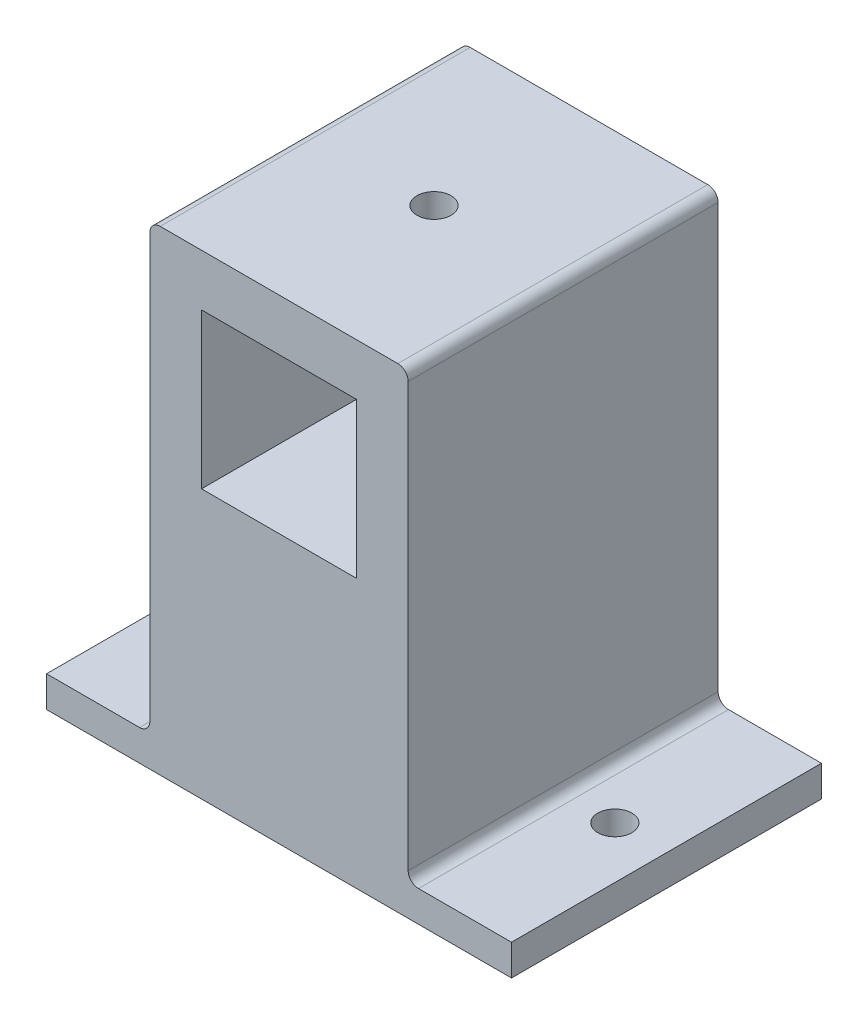
from build123d import *

# Parameters (mm, degrees)
SKETCH_1_W          = 25
SKETCH_1_H          = 25
SKETCH_1_W_2        = 15
SKETCH_1_H_2        = 15
EXTRUDE_1_DEPTH     = 30
SKETCH_2_W          = 25
SKETCH_2_H          = 18
SKETCH_2_W_2        = 10
SKETCH_2_H_2        = 3
EXTRUDE_2_DEPTH     = 30
SKETCH_3_R          = 1.65
CUT_EXTRUDE_1_DEPTH = 30
SKETCH_4_R          = 1.65
CUT_EXTRUDE_2_DEPTH = 1000
FILLET_1_R          = 1


with BuildPart() as part:
    # 草图1 → 凸台-拉伸1 (new body)
    with BuildSketch(Plane.XY):
        Rectangle(SKETCH_1_W, SKETCH_1_H)
        Rectangle(SKETCH_1_W_2, SKETCH_1_H_2, mode=Mode.SUBTRACT)
    extrude(amount=EXTRUDE_1_DEPTH)

    # 草图2 → 凸台-拉伸2 (add)
    with BuildSketch(Plane.XY.offset(30)):
        with Locations((0, -21.5)):
            Rectangle(SKETCH_2_W, SKETCH_2_H)
        with Locations((-17.5, -32)):
            Rectangle(SKETCH_2_W_2, SKETCH_2_H_2)
        with Locations((0, -32)):
            Rectangle(SKETCH_2_W, SKETCH_2_H_2)
        with Locations((17.5, -32)):
            Rectangle(SKETCH_2_W_2, SKETCH_2_H_2)
    extrude(amount=-EXTRUDE_2_DEPTH)

    # 草图3 → 切除-拉伸1 (cut)
    with BuildSketch(Plane(origin=(0, -30.5, 0), x_dir=(1, 0, 0), z_dir=(0, 1, 0))):
        with Locations(Location((17.5, -15, 0), (0, 0, 270))):
            Circle(SKETCH_3_R)
    cut_extrude_1 = extrude(amount=-CUT_EXTRUDE_1_DEPTH, mode=Mode.SUBTRACT)

    # 镜向1: 切除-拉伸1 across plane
    add(cut_extrude_1.mirror(Plane(origin=(0, 0, 0), x_dir=(0, 0, 1), z_dir=(1, 0, 0))), mode=Mode.SUBTRACT)

    # 草图4 → 切除-拉伸2 (cut)
    with BuildSketch(Plane(origin=(0, 12.5, 0), x_dir=(1, 0, 0), z_dir=(0, 1, 0))):
        with Locations(Location((0, -15, 0), (0, 0, 270))):
            Circle(SKETCH_4_R)
    extrude(amount=-CUT_EXTRUDE_2_DEPTH, mode=Mode.SUBTRACT)

    # 圆角1
    fillet_1_edges = [part.edges().sort_by_distance(p)[0] for p in [
        (-12.5, -30.5, 15),
        (12.5, -30.5, 15),
        (-12.5, 12.5, 15),
        (12.5, 12.5, 15),
    ]]
    fillet(fillet_1_edges, radius=FILLET_1_R)


solid = part.part
